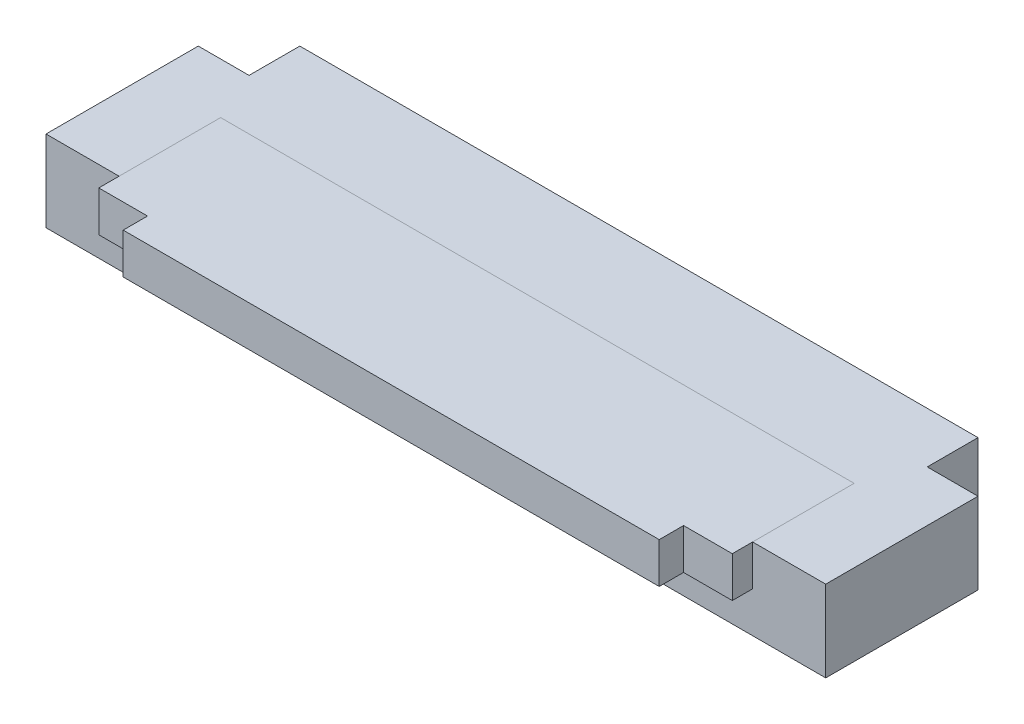
from build123d import *

# Parameters (mm, degrees)
BOSS_EXTRUDE2_DEPTH = 0.5
SKETCH9_W           = 9.6
SKETCH9_H           = 2.5
BOSS_EXTRUDE3_DEPTH = 1
SKETCH10_W          = 0.625
SKETCH10_H          = 0.625
CUT_EXTRUDE4_DEPTH  = 6.223025943
SKETCH11_W          = 0.625
SKETCH11_H          = 0.625
CUT_EXTRUDE5_DEPTH  = 6.223025943
SKETCH12_W          = 7.8
SKETCH12_H          = 1.25
CUT_EXTRUDE6_DEPTH  = 0.5


with BuildPart() as part:
    # Sketch8 → Boss-Extrude2 (new body)
    with BuildSketch(Plane(origin=(0, 1, 0), x_dir=(-1, 0, 0), z_dir=(0, 1, 0))):
        Polygon((-3.9, 1.5), (-3.9, 0), (3.9, 0), (3.9, 1.5), (3.3, 1.5), (3.3, 1.8), (-3.3, 1.8), (-3.3, 1.5), align=None)
    extrude(amount=-BOSS_EXTRUDE2_DEPTH)


with BuildPart() as body_2:
    # Sketch9 → Boss-Extrude3 (new body)
    with BuildSketch(Plane(origin=(0, 1, 0), x_dir=(-1, 0, 0), z_dir=(0, 1, 0))):
        Rectangle(SKETCH9_W, SKETCH9_H)
    extrude(amount=-BOSS_EXTRUDE3_DEPTH)

    # Sketch10 → Cut-Extrude4 (cut, through all)
    with BuildSketch(Plane.XZ):
        with Locations((4.4875, -0.9375)):
            Rectangle(SKETCH10_W, SKETCH10_H)
    extrude(amount=-CUT_EXTRUDE4_DEPTH, mode=Mode.SUBTRACT)

    # Sketch11 → Cut-Extrude5 (cut, through all)
    with BuildSketch(Plane.XZ):
        with Locations((-4.4875, -0.9375)):
            Rectangle(SKETCH11_W, SKETCH11_H)
    extrude(amount=-CUT_EXTRUDE5_DEPTH, mode=Mode.SUBTRACT)

    # Sketch12 → Cut-Extrude6 (cut)
    with BuildSketch(Plane(origin=(0, 1, 0), x_dir=(-1, 0, 0), z_dir=(0, 1, 0))):
        with Locations((0, 0.625)):
            Rectangle(SKETCH12_W, SKETCH12_H)
    extrude(amount=-CUT_EXTRUDE6_DEPTH, mode=Mode.SUBTRACT)


solid = Compound([part.part, body_2.part])
